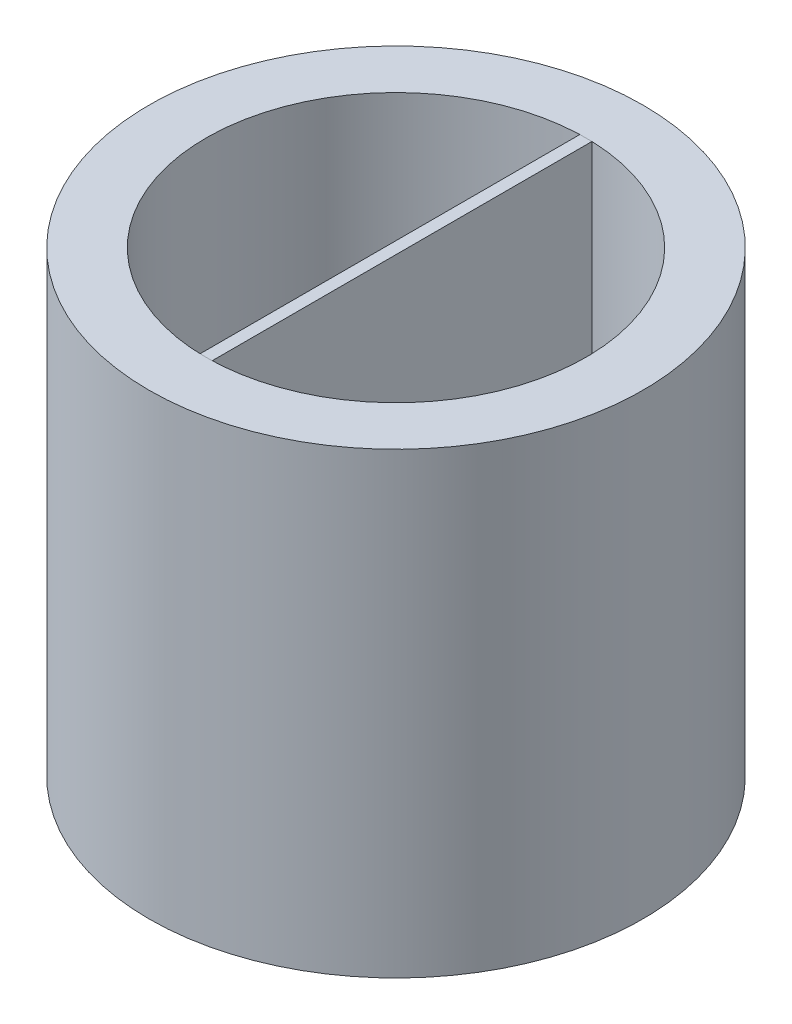
from build123d import *

# Parameters (mm, degrees)
SKETCH1_R           = 130
BOSS_EXTRUDE1_DEPTH = 241.01
SKETCH2_R           = 100
CUT_EXTRUDE1_DEPTH  = 304.126739335
SKETCH5_W           = 6.35
SKETCH5_H           = 199.899168332
BOSS_EXTRUDE2_DEPTH = 241.01


with BuildPart() as part:
    # Sketch1 → Boss-Extrude1 (new body)
    with BuildSketch(Plane(origin=(0, 0, 0), x_dir=(1, 0, 0), z_dir=(0, 1, 0))):
        with Locations(Location((0, 0, 0), (0, 0, 270))):
            Circle(SKETCH1_R)
    extrude(amount=BOSS_EXTRUDE1_DEPTH)

    # Sketch2 → Cut-Extrude1 (cut, through all)
    with BuildSketch(Plane(origin=(0, 241.01, 0), x_dir=(1, 0, 0), z_dir=(0, 1, 0))):
        with Locations(Location((0, 0, 0), (0, 0, 270))):
            Circle(SKETCH2_R)
    extrude(amount=-CUT_EXTRUDE1_DEPTH, mode=Mode.SUBTRACT)


with BuildPart() as body_2:
    # Sketch5 → Boss-Extrude2 (new body)
    with BuildSketch(Plane(origin=(0, 0, 0), x_dir=(1, 0, 0), z_dir=(0, 1, 0))):
        Rectangle(SKETCH5_W, SKETCH5_H)
    extrude(amount=BOSS_EXTRUDE2_DEPTH)


solid = Compound([part.part, body_2.part])
